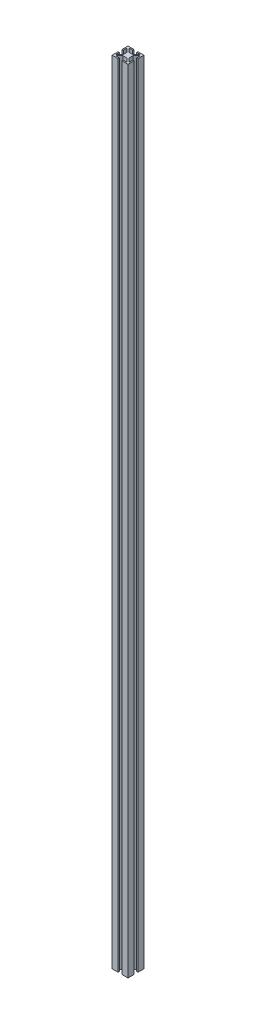
from build123d import *

# Parameters (mm, degrees)
BOSS_EXTRU_1_DEPTH = 1000


with BuildPart() as part:
    # Esquisse1 → Boss.-Extru.1 (new body)
    with BuildSketch(Plane(origin=(0, 0, 0), x_dir=(1, 0, 0), z_dir=(0, 1, 0))):
        with BuildLine():
            Line((-10, -2.5), (-10, -10))
            Line((-10, -10), (-2.5, -10))
            Line((-2.5, -10), (-2.5, -8.5))
            Line((-2.5, -8.5), (-6.232233047, -8.5))
            ThreePointArc((-6.232233047, -8.5), (-6.694172813, -8.191341716), (-6.585786438, -7.646446609))
            Line((-6.585786438, -7.646446609), (-2.689339828, -3.75))
            Line((-2.689339828, -3.75), (2.689339828, -3.75))
            Line((2.689339828, -3.75), (6.585786438, -7.646446609))
            ThreePointArc((6.585786438, -7.646446609), (6.694172813, -8.191341716), (6.232233047, -8.5))
            Line((6.232233047, -8.5), (2.5, -8.5))
            Line((2.5, -8.5), (2.5, -10))
            Line((2.5, -10), (10, -10))
            Line((10, -10), (10, -2.5))
            Line((10, -2.5), (8.5, -2.5))
            Line((8.5, -2.5), (8.5, -6.232233047))
            ThreePointArc((8.5, -6.232233047), (8.191341716, -6.694172813), (7.646446609, -6.585786438))
            Line((7.646446609, -6.585786438), (3.75, -2.689339828))
            Line((3.75, -2.689339828), (3.75, 2.689339828))
            Line((3.75, 2.689339828), (7.646446609, 6.585786438))
            ThreePointArc((7.646446609, 6.585786438), (8.191341716, 6.694172813), (8.5, 6.232233047))
            Line((8.5, 6.232233047), (8.5, 2.5))
            Line((8.5, 2.5), (10, 2.5))
            Line((10, 2.5), (10, 10))
            Line((10, 10), (2.5, 10))
            Line((2.5, 10), (2.5, 8.5))
            Line((2.5, 8.5), (6.232233047, 8.5))
            ThreePointArc((6.232233047, 8.5), (6.694172813, 8.191341716), (6.585786438, 7.646446609))
            Line((6.585786438, 7.646446609), (2.689339828, 3.75))
            Line((2.689339828, 3.75), (-2.689339828, 3.75))
            Line((-2.689339828, 3.75), (-6.585786438, 7.646446609))
            ThreePointArc((-6.585786438, 7.646446609), (-6.694172813, 8.191341716), (-6.232233047, 8.5))
            Line((-6.232233047, 8.5), (-2.5, 8.5))
            Line((-2.5, 8.5), (-2.5, 10))
            Line((-2.5, 10), (-10, 10))
            Line((-10, 10), (-10, 2.5))
            Line((-10, 2.5), (-8.5, 2.5))
            Line((-8.5, 2.5), (-8.5, 6.232233047))
            ThreePointArc((-8.5, 6.232233047), (-8.191341716, 6.694172813), (-7.646446609, 6.585786438))
            Line((-7.646446609, 6.585786438), (-3.75, 2.689339828))
            Line((-3.75, 2.689339828), (-3.75, -2.689339828))
            Line((-3.75, -2.689339828), (-7.646446609, -6.585786438))
            ThreePointArc((-7.646446609, -6.585786438), (-8.191341716, -6.694172813), (-8.5, -6.232233047))
            Line((-8.5, -6.232233047), (-8.5, -2.5))
            Line((-8.5, -2.5), (-10, -2.5))
        make_face()
    extrude(amount=BOSS_EXTRU_1_DEPTH)


solid = part.part
